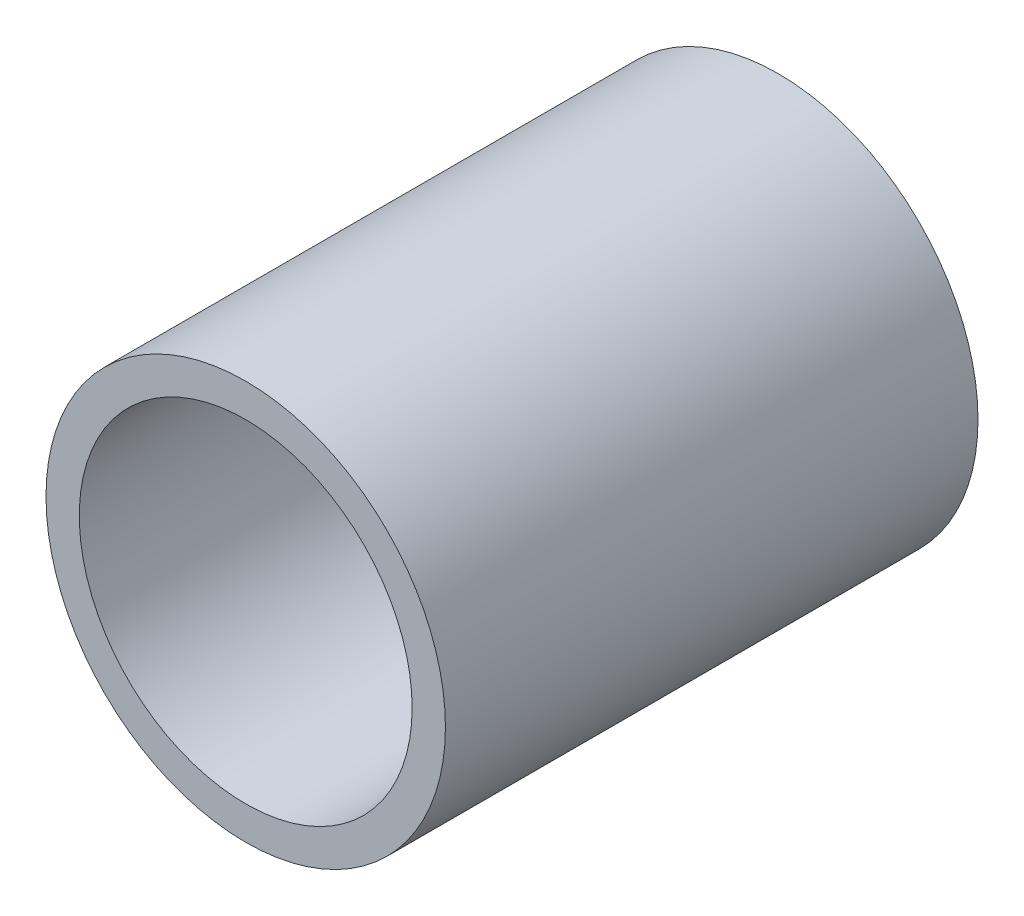
from build123d import *

# Parameters (mm, degrees)
SKETCH_1_R          = 15
EXTRUDE_1_DEPTH     = 40
SKETCH_2_R          = 12.5
CUT_EXTRUDE_1_DEPTH = 46.276925691


with BuildPart() as part:
    # Эскиз1 → Бобышка-Вытянуть1 (new body)
    with BuildSketch(Plane.XY):
        Circle(SKETCH_1_R)
    extrude(amount=EXTRUDE_1_DEPTH)

    # Эскиз2 → Вырез-Вытянуть1 (cut, through all)
    with BuildSketch(Plane.XY.offset(40)):
        Circle(SKETCH_2_R)
    extrude(amount=-CUT_EXTRUDE_1_DEPTH, mode=Mode.SUBTRACT)


solid = part.part
